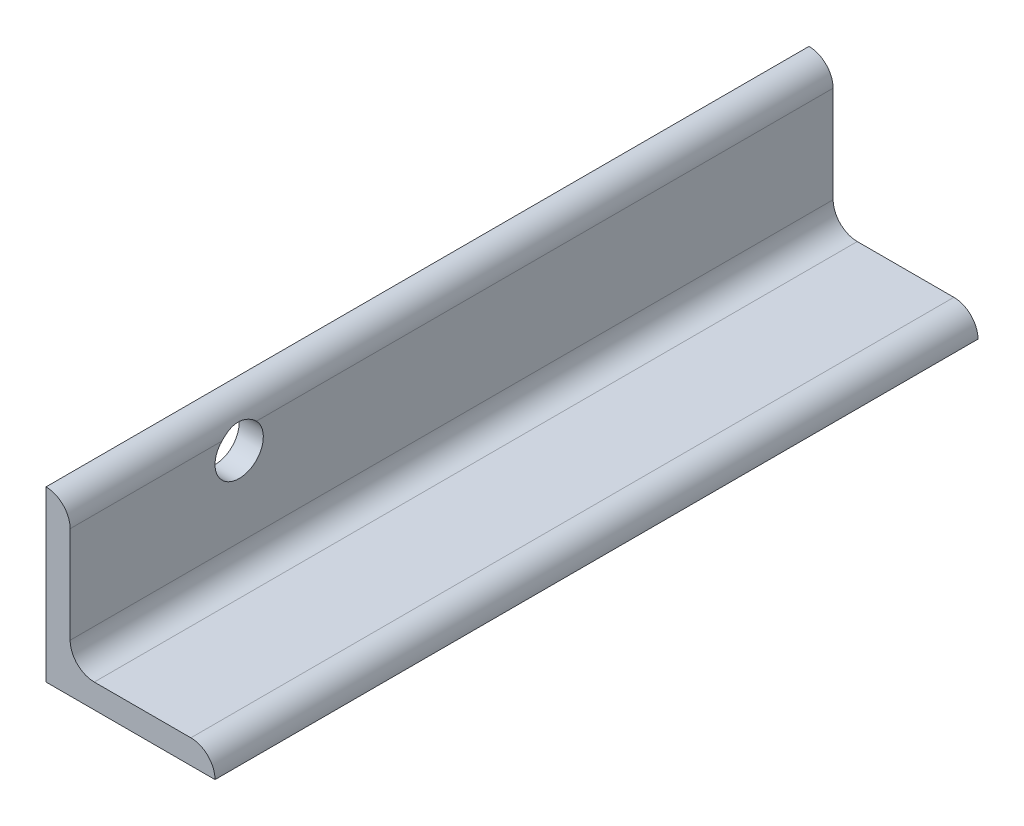
from build123d import *

# Parameters (mm, degrees)
K_TOWNIK_STALOWY_35_X_35_X_5_1_DEPTH = 158
SZKIC3_R                             = 5
WYTNIJ_WYCI_GNI_CIE1_DEPTH           = 10


with BuildPart() as part:
    # Sketch1 → Kątownik stalowy 35 X 35 X 5(1) (new body)
    with BuildSketch(Plane.YX.offset(-79)):
        with BuildLine():
            Line((0, 0), (0, 35))
            ThreePointArc((0, 35), (3.535533906, 33.535533906), (5, 30))
            Line((5, 30), (5, 10))
            ThreePointArc((5, 10), (6.464466094, 6.464466094), (10, 5))
            Line((10, 5), (30, 5))
            ThreePointArc((30, 5), (33.535533906, 3.535533906), (35, 0))
            Line((35, 0), (0, 0))
        make_face()
    extrude(amount=K_TOWNIK_STALOWY_35_X_35_X_5_1_DEPTH)

    # Szkic3 → Wytnij-wyciągnięcie1 (cut)
    with BuildSketch(Plane.ZY):
        with Locations((44, 26.5)):
            Circle(SZKIC3_R)
    extrude(amount=-WYTNIJ_WYCI_GNI_CIE1_DEPTH, mode=Mode.SUBTRACT)


solid = part.part
